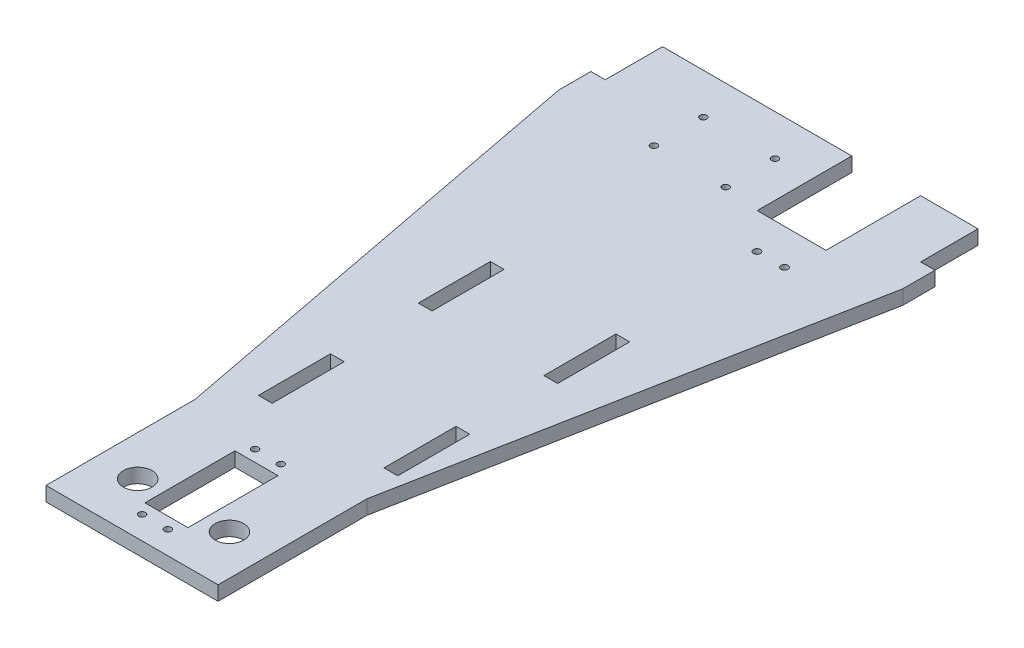
from build123d import *

# Parameters (mm, degrees)
SKETCH1_R           = 1.55
BOSS_EXTRUDE1_DEPTH = 6.35
SKETCH4_R           = 6.35
SKETCH4_W           = 6.35
SKETCH4_H           = 25.4
CUT_EXTRUDE2_DEPTH  = 250.304006214
SKETCH5_R           = 1.5
SKETCH5_W           = 19.05
SKETCH5_H           = 39.878
CUT_EXTRUDE3_DEPTH  = 250.304006214
SKETCH9_W           = 6.077459071
SKETCH9_H           = 31.906291655
SKETCH9_H_2         = 31.906291656
CUT_EXTRUDE4_DEPTH  = 37.338


with BuildPart() as part:
    # Sketch1 → Boss-Extrude1 (new body)
    with BuildSketch(Plane(origin=(0, 0, 0), x_dir=(1, 0, 0), z_dir=(0, 1, 0))):
        Polygon((-90.17, 72.46073058), (-90.17, 32.83673058), (-52.07, -166.371605632), (-52.07, -232.33926942), (24.13, -232.33926942), (24.13, -166.371605632), (62.23, 32.83673058), (62.23, 72.46073058), (30.48, 72.46073058), (30.48, 30.55073058), (0, 30.55073058), (0, 72.46073058), align=None)
        with Locations(Location((15.621, 14.819934213, 0), (0, 0, 270))):
            Circle(SKETCH1_R, mode=Mode.SUBTRACT)
        with Locations(Location((27.813, 14.819934213, 0), (0, 0, 270))):
            Circle(SKETCH1_R, mode=Mode.SUBTRACT)
    extrude(amount=BOSS_EXTRUDE1_DEPTH)

    # Sketch4 → Cut-Extrude2 (cut, through all)
    with BuildSketch(Plane(origin=(0, 6.35, 0), x_dir=(1, 0, 0), z_dir=(0, 1, 0))):
        with Locations(Location((-34.29, -209.515437526, 0), (0, 0, 270))):
            Circle(SKETCH4_R)
        with Locations(Location((6.35, -209.515437526, 0), (0, 0, 90))):
            Circle(SKETCH4_R)
        with Locations((59.055, 59.76073058)):
            Rectangle(SKETCH4_W, SKETCH4_H)
        with Locations((-86.995, 59.76073058)):
            Rectangle(SKETCH4_W, SKETCH4_H)
    extrude(amount=-CUT_EXTRUDE2_DEPTH, mode=Mode.SUBTRACT)

    # Sketch5 → Cut-Extrude3 (cut, through all)
    with BuildSketch(Plane(origin=(0, 6.35, 0), x_dir=(1, 0, 0), z_dir=(0, 1, 0))):
        with Locations(Location((-19.685, -222.17926942, 0), (0, 0, 270))):
            Circle(SKETCH5_R)
        with Locations(Location((-8.255, -222.17926942, 0), (0, 0, 270))):
            Circle(SKETCH5_R)
        with Locations(Location((-19.685, -172.14126942, 0), (0, 0, 270))):
            Circle(SKETCH5_R)
        with Locations(Location((-8.255, -172.14126942, 0), (0, 0, 270))):
            Circle(SKETCH5_R)
        with Locations(Location((-16.002, 54.42673058, 0), (0, 0, 270))):
            Circle(SKETCH5_R)
        with Locations(Location((-47.752, 54.42673058, 0), (0, 0, 270))):
            Circle(SKETCH5_R)
        with Locations(Location((-47.752, 32.58273058, 0), (0, 0, 270))):
            Circle(SKETCH5_R)
        with Locations(Location((-16.002, 32.58273058, 0), (0, 0, 270))):
            Circle(SKETCH5_R)
        with Locations((-13.97, -197.16026942)):
            Rectangle(SKETCH5_W, SKETCH5_H)
    extrude(amount=-CUT_EXTRUDE3_DEPTH, mode=Mode.SUBTRACT)

    # Sketch9 → Cut-Extrude4 (cut)
    with BuildSketch(Plane(origin=(0, 0, 0), x_dir=(1, 0, 0), z_dir=(0, 1, 0))):
        with Locations((19.088272024, -134.811490569)):
            Rectangle(SKETCH9_W, SKETCH9_H)
        with Locations((19.088272024, -63.999553047)):
            Rectangle(SKETCH9_W, SKETCH9_H_2)
        with Locations((-36.522018281, -134.811490569)):
            Rectangle(SKETCH9_W, SKETCH9_H)
        with Locations((-36.522018281, -63.999553047)):
            Rectangle(SKETCH9_W, SKETCH9_H_2)
    extrude(amount=CUT_EXTRUDE4_DEPTH, mode=Mode.SUBTRACT)


solid = part.part
